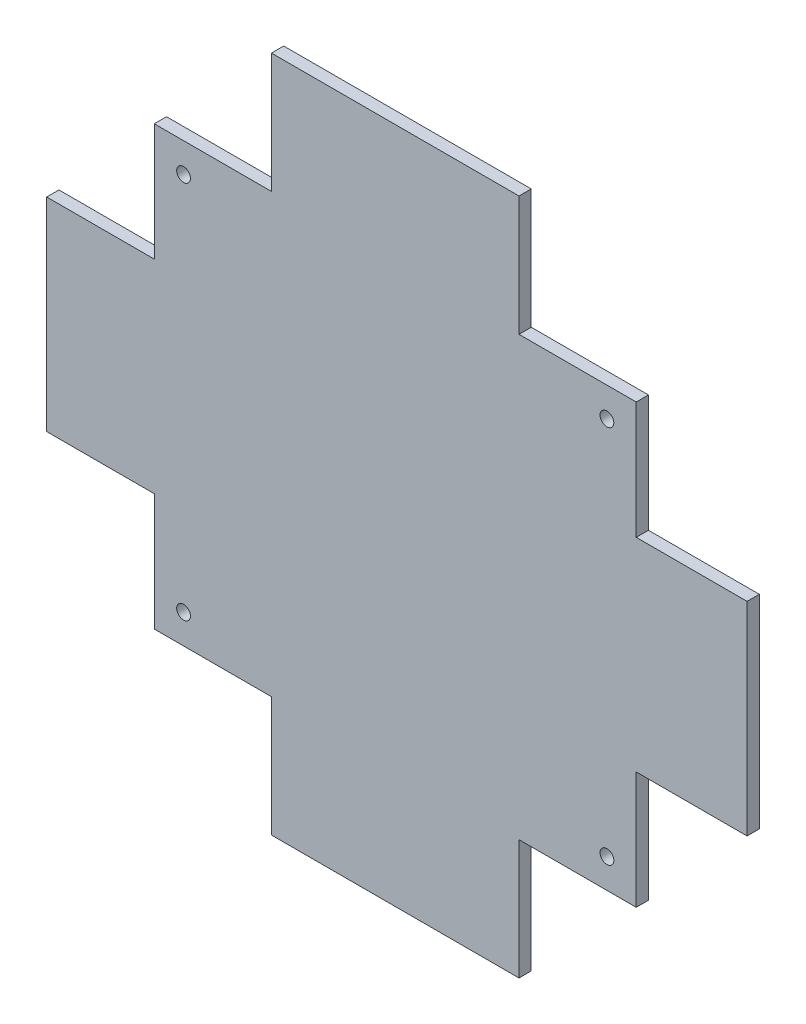
from build123d import *

# Parameters (mm, degrees)
BOSS_EXTRU_1_DEPTH = 6.35
ESQUISSE2_W        = 1.2
ESQUISSE2_H        = 105.4
BOSS_EXTRU_2_DEPTH = 6.35
D_GAGEMENT_1_41_D  = 7.14248


with BuildPart() as part:
    # Esquisse1 → Boss.-Extru.1 (new body)
    with BuildSketch(Plane.XY):
        Polygon((55.8, 113.5), (116.6, 113.5), (116.6, 175.65), (245, 175.65), (245, 113.5), (305.8, 113.5), (305.8, 52.7), (362.1, 52.7), (362.1, -52.7), (305.8, -52.7), (305.8, -113.5), (245, -113.5), (245, -175.65), (116.6, -175.65), (116.6, -113.5), (55.8, -113.5), (55.8, -52.7), (0, -52.7), (0, 52.7), (55.8, 52.7), align=None)
    extrude(amount=BOSS_EXTRU_1_DEPTH)

    # Esquisse2 → Boss.-Extru.2 (add, through all)
    with BuildSketch(Plane.XY.offset(6.35)):
        with Locations((362.7, 0)):
            Rectangle(ESQUISSE2_W, ESQUISSE2_H)
    extrude(amount=-BOSS_EXTRU_2_DEPTH)

    # Dégagement 1/41 (through all)
    with Locations(Plane(origin=(0, 0, 0), x_dir=(-1, 0, 0), z_dir=(0, 0, -1))):
        with Locations((-290.6, 98.3), (-71, 98.3), (-71, -98.3), (-290.6, -98.3)):
            Hole(D_GAGEMENT_1_41_D / 2)


solid = part.part
